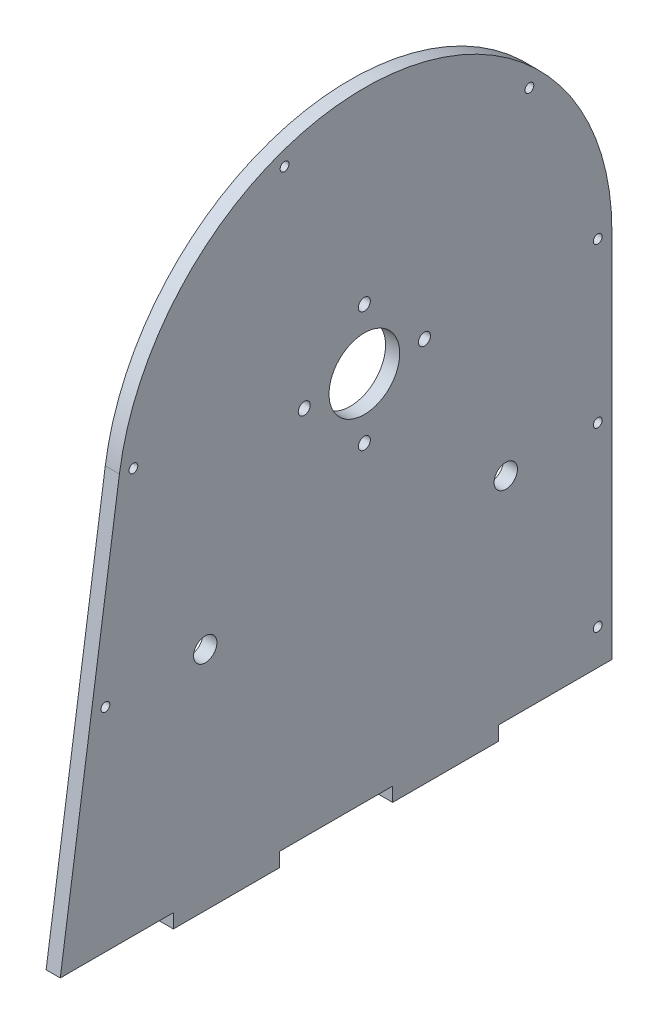
from build123d import *

# Parameters (mm, degrees)
AUFSATZ_LINEAR_AUSTRAGEN1_DEPTH      = 4
SKIZZE1_9_R                          = 10
SCHNITT_LINEAR_AUSTRAGEN1_DEPTH      = 6
SCHNITT_LINEAR_AUSTRAGEN2_DEPTH      = 251.325290812
SCHNITT_LINEAR_AUSTRAGEN2_DEPTH_BACK = 10
M3_GEWINDEBOHRUNG1_D                 = 2.5
M3_GEWINDEBOHRUNG1_DEPTH             = 8.5
M3_GEWINDEBOHRUNG1_TIP               = 0.751075774
KREISMUSTER1_COUNT                   = 4
DURCHGANGSLOCH_F_R_M61_D             = 6.6
DURCHGANGSLOCH_F_R_M61_DEPTH         = 17
DURCHGANGSLOCH_F_R_M61_TIP           = 1.982840043
SKIZZE32_W                           = 4
SKIZZE32_H                           = 30
AUFSATZ_LINEAR_AUSTRAGEN2_DEPTH      = 4


with BuildPart() as part:
    # Skizze1 → Aufsatz-Linear austragen1 (new body)
    with BuildSketch(Plane(origin=(0, 0, 0), x_dir=(0, 0, -1), z_dir=(1, 0, 0))):
        with BuildLine():
            Line((-120.903454086, -13.395859459), (-120.903454086, -24.075118314))
            ThreePointArc((-120.903454086, -24.075118314), (-140.453351678, -44.726591756), (-150.175306123, -71.450465968))
            Line((-150.175306123, -71.450465968), (-166.903454086, -186.520744783))
            Line((-166.903454086, -186.520744783), (-10.903454086, -186.520744783))
            Line((-10.903454086, -186.520744783), (-1.903454086, -186.520744783))
            Line((-1.903454086, -186.520744783), (-1.903454086, -81.52074478))
            ThreePointArc((-1.903454086, -81.52074478), (-41.654250272, -12.960552248), (-120.903454086, -13.395859459))
        make_face()
    extrude(amount=AUFSATZ_LINEAR_AUSTRAGEN1_DEPTH)

    # Skizze1<9> → Schnitt-Linear austragen1 (cut)
    with BuildSketch(Plane(origin=(0, 0, 0), x_dir=(0, 0, -1), z_dir=(1, 0, 0))):
        with Locations((-80.903454086, -81.52074478)):
            Circle(SKIZZE1_9_R)
    extrude(amount=SCHNITT_LINEAR_AUSTRAGEN1_DEPTH, mode=Mode.SUBTRACT)

    # Skizze3 → Durchgangsloch für M31 (revolve, cut)
    with BuildSketch(Plane(origin=(0, -81.52074478, 63.903454086), x_dir=(0, 0, 1), z_dir=(0, 1, 0))):
        Polygon((0, 0), (0, 21.021463052), (1.7, 20), (1.7, 0), align=None)
    durchgangsloch_f_r_m31 = revolve(axis=Axis((-6.35, -81.52074478, 63.903454086), (1, 0, 0)), mode=Mode.SUBTRACT)

    # Skizze1<18> → Schnitt-Linear austragen2 (cut, two sides: drawn at the far end of the back side and taken through both)
    with BuildSketch(Plane(origin=(0, 0, 0), x_dir=(0, 0, -1), z_dir=(1, 0, 0)).offset(-SCHNITT_LINEAR_AUSTRAGEN2_DEPTH_BACK)):
        with BuildLine():
            ThreePointArc((-1.903454086, -81.52074478), (-41.654250272, -12.960552248), (-120.903454086, -13.395859459))
            Line((-120.903454086, -13.395859459), (-120.903454086, -24.075118314))
            ThreePointArc((-120.903454086, -24.075118314), (-48.499750594, -19.47237655), (-10.903454086, -81.52074478))
            Line((-10.903454086, -81.52074478), (-10.903454086, -186.520744783))
            Line((-10.903454086, -186.520744783), (-1.903454086, -186.520744783))
            Line((-1.903454086, -186.520744783), (-1.903454086, -81.52074478))
        make_face()
    extrude(amount=SCHNITT_LINEAR_AUSTRAGEN2_DEPTH + SCHNITT_LINEAR_AUSTRAGEN2_DEPTH_BACK, mode=Mode.SUBTRACT)

    # M3 Gewindebohrung1
    with Locations(Plane.YZ.offset(4)):
        with Locations((-176.520744783, 14.903454086), (-126.520744783, 14.903454086), (-34.851697221, 34.234406527), (-19.501031808, 103.476783545), (-81.52074478, 14.903454086), (-72.025910472, 146.216914578), (-126.520744783, 154.139009327)):
            Hole(M3_GEWINDEBOHRUNG1_D / 2, depth=M3_GEWINDEBOHRUNG1_DEPTH)
            with Locations((0, 0, -(M3_GEWINDEBOHRUNG1_DEPTH + M3_GEWINDEBOHRUNG1_TIP / 2))):  # 118° drill point
                Cone(0, M3_GEWINDEBOHRUNG1_D / 2, M3_GEWINDEBOHRUNG1_TIP, mode=Mode.SUBTRACT)

    # Kreismuster1: Durchgangsloch für M31 ×4 about axis
    kreismuster1_axis = Axis((0, -81.52074478, 80.903454086), (1, 0, 0))
    for i in range(1, KREISMUSTER1_COUNT):
        add(durchgangsloch_f_r_m31.rotate(kreismuster1_axis, i * 360 / KREISMUSTER1_COUNT), mode=Mode.SUBTRACT)

    # Durchgangsloch für M61
    with Locations(Plane.ZY):
        with Locations((40.903454086, -126.520744783), (125.903454086, -126.520744783)):
            Hole(DURCHGANGSLOCH_F_R_M61_D / 2, depth=DURCHGANGSLOCH_F_R_M61_DEPTH)
            with Locations((0, 0, -(DURCHGANGSLOCH_F_R_M61_DEPTH + DURCHGANGSLOCH_F_R_M61_TIP / 2))):  # 118° drill point
                Cone(0, DURCHGANGSLOCH_F_R_M61_D / 2, DURCHGANGSLOCH_F_R_M61_TIP, mode=Mode.SUBTRACT)

    # Skizze32 → Aufsatz-Linear austragen2 (add)
    with BuildSketch(Plane.XZ.offset(186.520744783)):
        with Locations((2, 119.903454086)):
            Rectangle(SKIZZE32_W, SKIZZE32_H)
        with Locations((2, 57.903454086)):
            Rectangle(SKIZZE32_W, SKIZZE32_H)
    extrude(amount=AUFSATZ_LINEAR_AUSTRAGEN2_DEPTH)


solid = part.part
